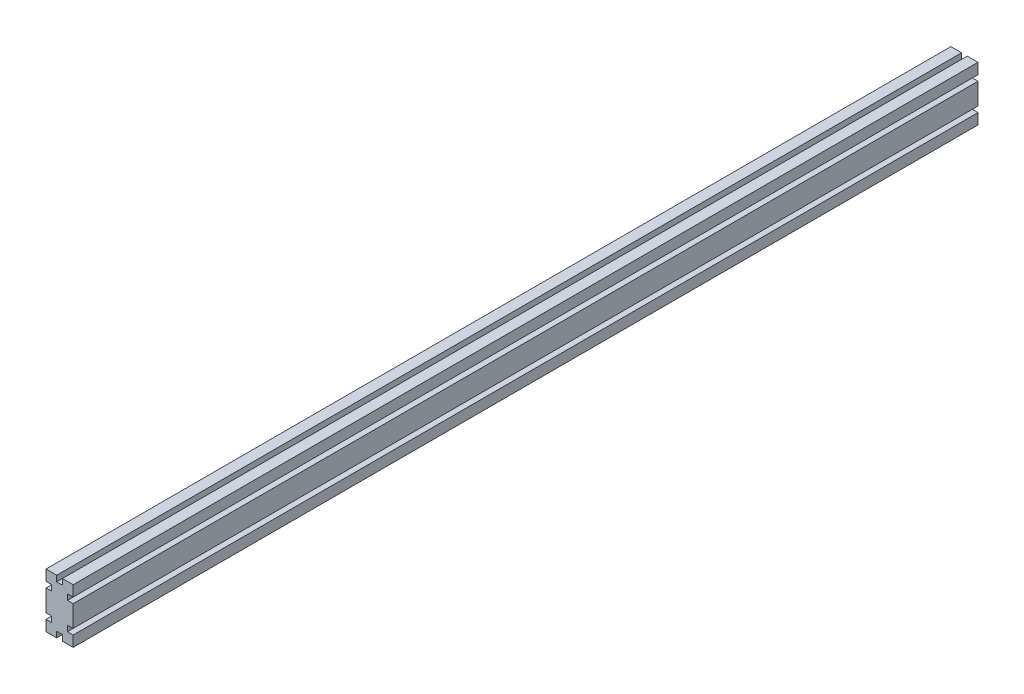
from build123d import *

# Parameters (mm, degrees)
PROFILE_DEPTH = 1270


with BuildPart() as part:
    # Sketch1 → Profile (new body)
    with BuildSketch(Plane.XY):
        Polygon((-19.05, -38.1), (-4, -38.1), (-4, -30.1), (4, -30.1), (4, -38.1), (19.05, -38.1), (19.05, -23.05), (11.05, -23.05), (11.05, -15.05), (19.05, -15.05), (19.05, 15.05), (11.05, 15.05), (11.05, 23.05), (19.05, 23.05), (19.05, 38.1), (4, 38.1), (4, 30.1), (-4, 30.1), (-4, 38.1), (-19.05, 38.1), (-19.05, 23.05), (-11.05, 23.05), (-11.05, 15.05), (-19.05, 15.05), (-19.05, -15.05), (-11.05, -15.05), (-11.05, -23.05), (-19.05, -23.05), align=None)
    extrude(amount=PROFILE_DEPTH)


solid = part.part
